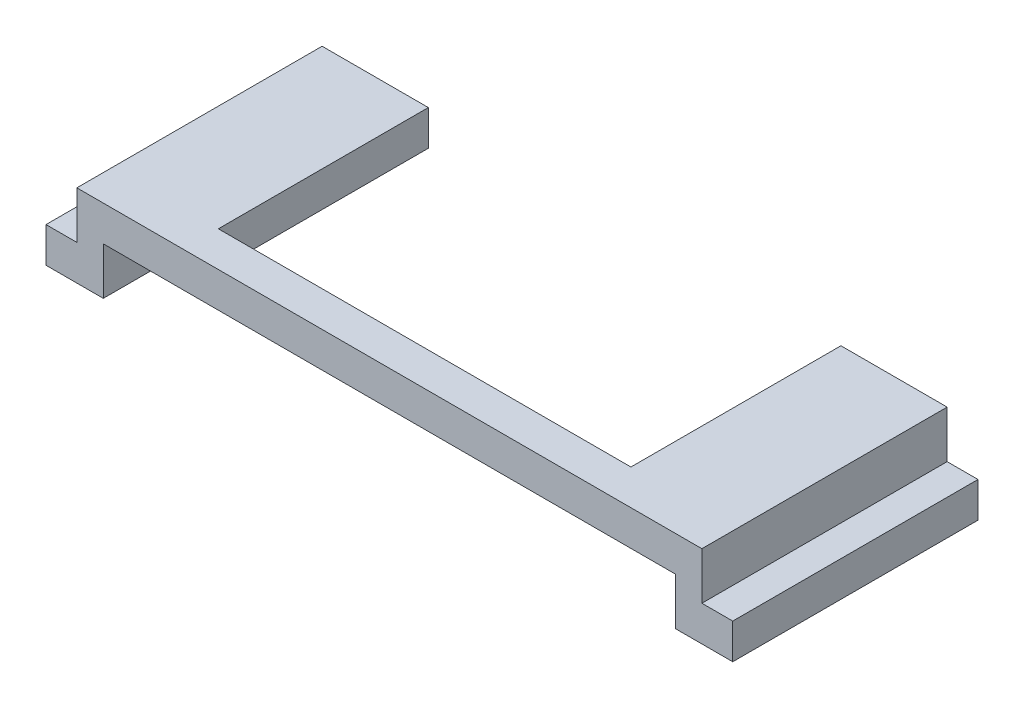
from build123d import *

# Parameters (mm, degrees)
BOSS_EXTRUDE1_DEPTH = 13.91
CUT_EXTRUDE1_REACH  = 26.386
SKETCH2_W           = 23.4
SKETCH2_H           = 11.91


with BuildPart() as part:
    # Sketch1 → Boss-Extrude1 (new body)
    with BuildSketch(Plane.XY):
        Polygon((-19.475, -2.68), (-16.225, -2.68), (-16.225, 0), (16.225, 0), (16.225, -2.68), (19.475, -2.68), (19.475, -0.68), (17.725, -0.68), (17.725, 2), (-17.725, 2), (-17.725, -0.68), (-19.475, -0.68), align=None)
    extrude(amount=BOSS_EXTRUDE1_DEPTH)

    # Sketch2 → Cut-Extrude1 (cut, up to next)
    with BuildSketch(Plane(origin=(0, 2, 0), x_dir=(1, 0, 0), z_dir=(0, 1, 0)), mode=Mode.PRIVATE) as cut_extrude1_sk1:
        with Locations((0, -5.955)):
            Rectangle(SKETCH2_W, SKETCH2_H)
    cut_extrude1_tool1 = extrude(cut_extrude1_sk1.sketch, amount=-CUT_EXTRUDE1_REACH, mode=Mode.PRIVATE) & part.part
    add(cut_extrude1_tool1.solids().sort_by_distance((0, 2, 5.955))[0], mode=Mode.SUBTRACT)


solid = part.part
